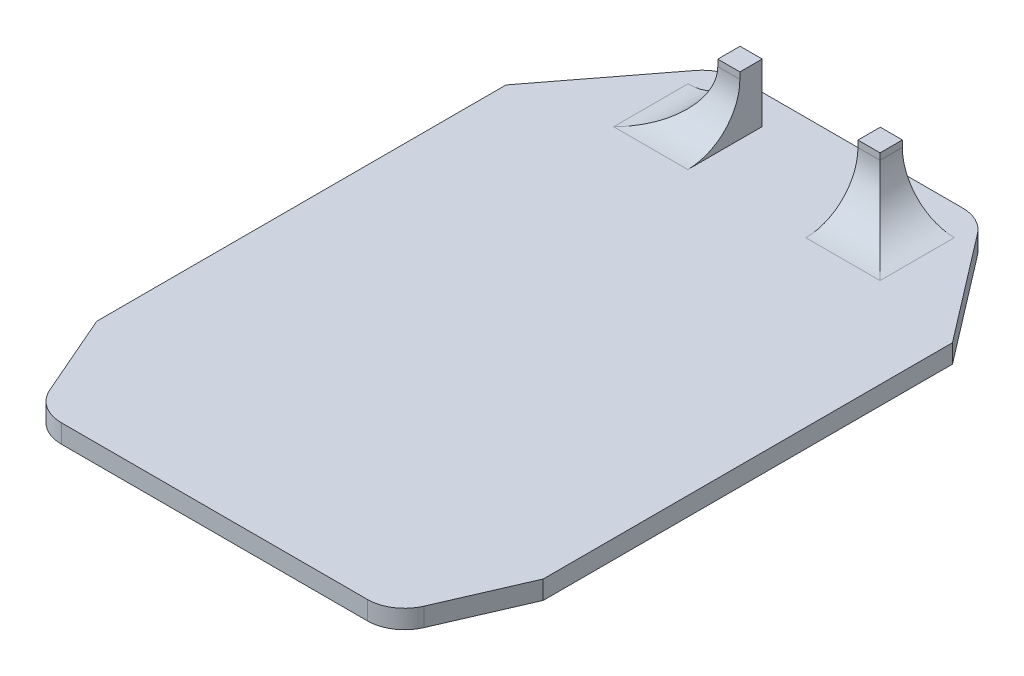
from build123d import *

# Parameters (mm, degrees)
BOSS_EXTRUDE1_DEPTH = 6.35
SKETCH2_W           = 7.5438
SKETCH2_H           = 7.62
BOSS_EXTRUDE2_DEPTH = 19.9898
FILLET1_R           = 17.78
SKETCH3_R           = 1.3462
CUT_EXTRUDE1_DEPTH  = 5.4102


with BuildPart() as part:
    # Sketch1 → Boss-Extrude1 (new body)
    with BuildSketch(Plane(origin=(0, 0, 0), x_dir=(1, 0, 0), z_dir=(0, 1, 0))):
        with BuildLine():
            Line((88.9, 141.121005256), (50.8, 141.121005256))
            Line((50.8, 141.121005256), (50.8, -76.2))
            Line((50.8, -76.2), (103.023285942, -76.2))
            ThreePointArc((103.023285942, -76.2), (109.991730457, -74.117475267), (114.674827247, -68.552878903))
            Line((114.674827247, -68.552878903), (127, -40.132))
            Line((127, -40.132), (127, 99.568))
            Line((127, 99.568), (98.981931967, 136.144))
            ThreePointArc((98.981931967, 136.144), (94.521742023, 139.808982101), (88.9, 141.121005256))
        make_face()
        with BuildLine():
            Line((50.8, 141.121005256), (12.7, 141.121005256))
            ThreePointArc((12.7, 141.121005256), (7.078257977, 139.808982101), (2.618068033, 136.144))
            Line((2.618068033, 136.144), (-25.4, 99.568))
            Line((-25.4, 99.568), (-25.4, -40.132))
            Line((-25.4, -40.132), (-13.074827247, -68.552878903))
            ThreePointArc((-13.074827247, -68.552878903), (-8.391730457, -74.117475267), (-1.423285942, -76.2))
            Line((-1.423285942, -76.2), (50.8, -76.2))
            Line((50.8, -76.2), (50.8, 141.121005256))
        make_face()
    extrude(amount=BOSS_EXTRUDE1_DEPTH)

    # Sketch2 → Boss-Extrude2 (add)
    with BuildSketch(Plane(origin=(0, 6.35, 0), x_dir=(1, 0, 0), z_dir=(0, 1, 0))):
        with Locations((74.7268, 127.151005256)):
            Rectangle(SKETCH2_W, SKETCH2_H)
        with Locations((26.8732, 127.151005256)):
            Rectangle(SKETCH2_W, SKETCH2_H)
    extrude(amount=BOSS_EXTRUDE2_DEPTH)

    # Fillet1
    fillet1_edges = [part.edges().sort_by_distance(p)[0] for p in [
        (23.1013, 6.35, -127.151005256),
        (26.8732, 6.35, -123.341005256),
        (78.4987, 6.35, -127.151005256),
        (74.7268, 6.35, -123.341005256),
    ]]
    fillet(fillet1_edges, radius=FILLET1_R)

    # Sketch3 → Cut-Extrude1 (cut)
    with BuildSketch(Plane(origin=(0, 0, -130.961005256), x_dir=(-1, 0, 0), z_dir=(0, 0, -1))):
        with Locations((-75.2983, 11.3538)):
            Circle(SKETCH3_R)
        with Locations((-75.2983, 21.3614)):
            Circle(SKETCH3_R)
        with Locations(Location((-26.3017, 11.3538, 0), (0, 0, 180))):
            Circle(SKETCH3_R)
        with Locations(Location((-26.3017, 21.3614, 0), (0, 0, 180))):
            Circle(SKETCH3_R)
    extrude(amount=-CUT_EXTRUDE1_DEPTH, mode=Mode.SUBTRACT)


solid = part.part
